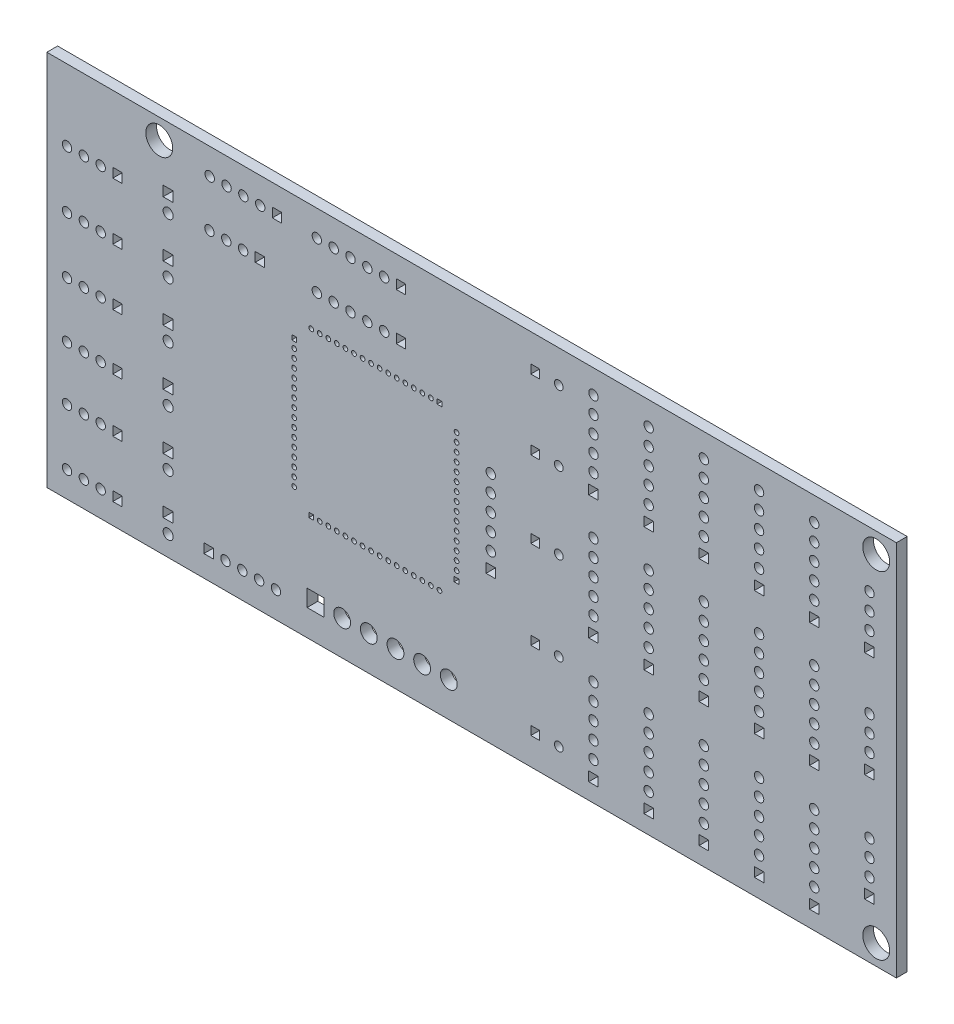
from build123d import *

# Parameters (mm, degrees)
MODEL_R             = 1.25
MODEL_R_2           = 0.35
MODEL_R_3           = 0.75
MODEL_R_4           = 0.7
MODEL_R_5           = 0.65
MODEL_R_6           = 2
MODEL_W             = 2.5
MODEL_H             = 2.5
MODEL_W_2           = 0.7
MODEL_H_2           = 0.7
MODEL_W_3           = 1.5
MODEL_H_3           = 1.5
MODEL_W_4           = 1.4
MODEL_H_4           = 1.4
MODEL_W_5           = 1.3
MODEL_H_5           = 1.3
BOSS_EXTRUDE1_DEPTH = 1.6


with BuildPart() as part:
    # Model → Boss-Extrude1 (new body)
    with BuildSketch(Plane.XY):
        Polygon((0, 0), (106, 0), (112.5, 0), (112.5, 56), (106, 56), (0, 56), (-13.7, 56), (-13.7, 0), align=None)
        with Locations((30.17, 5.14)):
            Circle(MODEL_R, mode=Mode.SUBTRACT)
        with Locations((34.13, 5.14)):
            Circle(MODEL_R, mode=Mode.SUBTRACT)
        with Locations((38.09, 5.14)):
            Circle(MODEL_R, mode=Mode.SUBTRACT)
        with Locations((42.05, 5.14)):
            Circle(MODEL_R, mode=Mode.SUBTRACT)
        with Locations((46.01, 5.14)):
            Circle(MODEL_R, mode=Mode.SUBTRACT)
        with Locations((23.035, 36.255)):
            Circle(MODEL_R_2, mode=Mode.SUBTRACT)
        with Locations((23.035, 34.985)):
            Circle(MODEL_R_2, mode=Mode.SUBTRACT)
        with Locations((23.035, 33.715)):
            Circle(MODEL_R_2, mode=Mode.SUBTRACT)
        with Locations((23.035, 32.445)):
            Circle(MODEL_R_2, mode=Mode.SUBTRACT)
        with Locations((23.035, 31.175)):
            Circle(MODEL_R_2, mode=Mode.SUBTRACT)
        with Locations((23.035, 29.905)):
            Circle(MODEL_R_2, mode=Mode.SUBTRACT)
        with Locations((23.035, 28.635)):
            Circle(MODEL_R_2, mode=Mode.SUBTRACT)
        with Locations((23.035, 27.365)):
            Circle(MODEL_R_2, mode=Mode.SUBTRACT)
        with Locations((23.035, 26.095)):
            Circle(MODEL_R_2, mode=Mode.SUBTRACT)
        with Locations((23.035, 24.825)):
            Circle(MODEL_R_2, mode=Mode.SUBTRACT)
        with Locations((23.035, 23.555)):
            Circle(MODEL_R_2, mode=Mode.SUBTRACT)
        with Locations((23.035, 22.285)):
            Circle(MODEL_R_2, mode=Mode.SUBTRACT)
        with Locations((23.035, 21.015)):
            Circle(MODEL_R_2, mode=Mode.SUBTRACT)
        with Locations((23.035, 19.745)):
            Circle(MODEL_R_2, mode=Mode.SUBTRACT)
        with Locations((23.035, 18.475)):
            Circle(MODEL_R_2, mode=Mode.SUBTRACT)
        with Locations((26.845, 15.935)):
            Circle(MODEL_R_2, mode=Mode.SUBTRACT)
        with Locations((28.115, 15.935)):
            Circle(MODEL_R_2, mode=Mode.SUBTRACT)
        with Locations((29.385, 15.935)):
            Circle(MODEL_R_2, mode=Mode.SUBTRACT)
        with Locations((30.655, 15.935)):
            Circle(MODEL_R_2, mode=Mode.SUBTRACT)
        with Locations((31.925, 15.935)):
            Circle(MODEL_R_2, mode=Mode.SUBTRACT)
        with Locations((33.195, 15.935)):
            Circle(MODEL_R_2, mode=Mode.SUBTRACT)
        with Locations((34.465, 15.935)):
            Circle(MODEL_R_2, mode=Mode.SUBTRACT)
        with Locations((35.735, 15.935)):
            Circle(MODEL_R_2, mode=Mode.SUBTRACT)
        with Locations((37.005, 15.935)):
            Circle(MODEL_R_2, mode=Mode.SUBTRACT)
        with Locations((38.275, 15.935)):
            Circle(MODEL_R_2, mode=Mode.SUBTRACT)
        with Locations((39.545, 15.935)):
            Circle(MODEL_R_2, mode=Mode.SUBTRACT)
        with Locations((40.815, 15.935)):
            Circle(MODEL_R_2, mode=Mode.SUBTRACT)
        with Locations((42.085, 15.935)):
            Circle(MODEL_R_2, mode=Mode.SUBTRACT)
        with Locations((43.355, 15.935)):
            Circle(MODEL_R_2, mode=Mode.SUBTRACT)
        with Locations((44.625, 15.935)):
            Circle(MODEL_R_2, mode=Mode.SUBTRACT)
        with Locations((47.165, 19.745)):
            Circle(MODEL_R_2, mode=Mode.SUBTRACT)
        with Locations((47.165, 21.015)):
            Circle(MODEL_R_2, mode=Mode.SUBTRACT)
        with Locations((47.165, 22.285)):
            Circle(MODEL_R_2, mode=Mode.SUBTRACT)
        with Locations((47.165, 23.555)):
            Circle(MODEL_R_2, mode=Mode.SUBTRACT)
        with Locations((47.165, 24.825)):
            Circle(MODEL_R_2, mode=Mode.SUBTRACT)
        with Locations((47.165, 26.095)):
            Circle(MODEL_R_2, mode=Mode.SUBTRACT)
        with Locations((47.165, 27.365)):
            Circle(MODEL_R_2, mode=Mode.SUBTRACT)
        with Locations((47.165, 28.635)):
            Circle(MODEL_R_2, mode=Mode.SUBTRACT)
        with Locations((47.165, 29.905)):
            Circle(MODEL_R_2, mode=Mode.SUBTRACT)
        with Locations((47.165, 31.175)):
            Circle(MODEL_R_2, mode=Mode.SUBTRACT)
        with Locations((47.165, 32.445)):
            Circle(MODEL_R_2, mode=Mode.SUBTRACT)
        with Locations((47.165, 33.715)):
            Circle(MODEL_R_2, mode=Mode.SUBTRACT)
        with Locations((47.165, 34.985)):
            Circle(MODEL_R_2, mode=Mode.SUBTRACT)
        with Locations((47.165, 36.255)):
            Circle(MODEL_R_2, mode=Mode.SUBTRACT)
        with Locations((47.165, 37.525)):
            Circle(MODEL_R_2, mode=Mode.SUBTRACT)
        with Locations((43.355, 40.065)):
            Circle(MODEL_R_2, mode=Mode.SUBTRACT)
        with Locations((42.085, 40.065)):
            Circle(MODEL_R_2, mode=Mode.SUBTRACT)
        with Locations((40.815, 40.065)):
            Circle(MODEL_R_2, mode=Mode.SUBTRACT)
        with Locations((39.545, 40.065)):
            Circle(MODEL_R_2, mode=Mode.SUBTRACT)
        with Locations((38.275, 40.065)):
            Circle(MODEL_R_2, mode=Mode.SUBTRACT)
        with Locations((37.005, 40.065)):
            Circle(MODEL_R_2, mode=Mode.SUBTRACT)
        with Locations((35.735, 40.065)):
            Circle(MODEL_R_2, mode=Mode.SUBTRACT)
        with Locations((34.465, 40.065)):
            Circle(MODEL_R_2, mode=Mode.SUBTRACT)
        with Locations((33.195, 40.065)):
            Circle(MODEL_R_2, mode=Mode.SUBTRACT)
        with Locations((31.925, 40.065)):
            Circle(MODEL_R_2, mode=Mode.SUBTRACT)
        with Locations((30.655, 40.065)):
            Circle(MODEL_R_2, mode=Mode.SUBTRACT)
        with Locations((29.385, 40.065)):
            Circle(MODEL_R_2, mode=Mode.SUBTRACT)
        with Locations((28.115, 40.065)):
            Circle(MODEL_R_2, mode=Mode.SUBTRACT)
        with Locations((26.845, 40.065)):
            Circle(MODEL_R_2, mode=Mode.SUBTRACT)
        with Locations((25.575, 40.065)):
            Circle(MODEL_R_2, mode=Mode.SUBTRACT)
        with Locations((4.32, 44.29)):
            Circle(MODEL_R_3, mode=Mode.SUBTRACT)
        with Locations((4.32, 36.035)):
            Circle(MODEL_R_3, mode=Mode.SUBTRACT)
        with Locations((4.32, 27.78)):
            Circle(MODEL_R_3, mode=Mode.SUBTRACT)
        with Locations((4.32, 19.525)):
            Circle(MODEL_R_3, mode=Mode.SUBTRACT)
        with Locations((4.32, 11.27)):
            Circle(MODEL_R_3, mode=Mode.SUBTRACT)
        with Locations((4.32, 3.015)):
            Circle(MODEL_R_3, mode=Mode.SUBTRACT)
        with Locations((92.1, 42.5)):
            Circle(MODEL_R_4, mode=Mode.SUBTRACT)
        with Locations((92.1, 45)):
            Circle(MODEL_R_4, mode=Mode.SUBTRACT)
        with Locations((92.1, 47.5)):
            Circle(MODEL_R_4, mode=Mode.SUBTRACT)
        with Locations((92.1, 50)):
            Circle(MODEL_R_4, mode=Mode.SUBTRACT)
        with Locations((92.1, 52.5)):
            Circle(MODEL_R_4, mode=Mode.SUBTRACT)
        with Locations((83.9, 42.5)):
            Circle(MODEL_R_4, mode=Mode.SUBTRACT)
        with Locations((83.9, 45)):
            Circle(MODEL_R_4, mode=Mode.SUBTRACT)
        with Locations((83.9, 47.5)):
            Circle(MODEL_R_4, mode=Mode.SUBTRACT)
        with Locations((83.9, 50)):
            Circle(MODEL_R_4, mode=Mode.SUBTRACT)
        with Locations((83.9, 52.5)):
            Circle(MODEL_R_4, mode=Mode.SUBTRACT)
        with Locations((75.7, 42.5)):
            Circle(MODEL_R_4, mode=Mode.SUBTRACT)
        with Locations((75.7, 45)):
            Circle(MODEL_R_4, mode=Mode.SUBTRACT)
        with Locations((75.7, 47.5)):
            Circle(MODEL_R_4, mode=Mode.SUBTRACT)
        with Locations((75.7, 50)):
            Circle(MODEL_R_4, mode=Mode.SUBTRACT)
        with Locations((75.7, 52.5)):
            Circle(MODEL_R_4, mode=Mode.SUBTRACT)
        with Locations((67.5, 42.5)):
            Circle(MODEL_R_4, mode=Mode.SUBTRACT)
        with Locations((67.5, 45)):
            Circle(MODEL_R_4, mode=Mode.SUBTRACT)
        with Locations((67.5, 47.5)):
            Circle(MODEL_R_4, mode=Mode.SUBTRACT)
        with Locations((67.5, 50)):
            Circle(MODEL_R_4, mode=Mode.SUBTRACT)
        with Locations((67.5, 52.5)):
            Circle(MODEL_R_4, mode=Mode.SUBTRACT)
        with Locations((92.1, 24.1)):
            Circle(MODEL_R_4, mode=Mode.SUBTRACT)
        with Locations((92.1, 26.6)):
            Circle(MODEL_R_4, mode=Mode.SUBTRACT)
        with Locations((92.1, 29.1)):
            Circle(MODEL_R_4, mode=Mode.SUBTRACT)
        with Locations((92.1, 31.6)):
            Circle(MODEL_R_4, mode=Mode.SUBTRACT)
        with Locations((92.1, 34.1)):
            Circle(MODEL_R_4, mode=Mode.SUBTRACT)
        with Locations((83.9, 24.1)):
            Circle(MODEL_R_4, mode=Mode.SUBTRACT)
        with Locations((83.9, 26.6)):
            Circle(MODEL_R_4, mode=Mode.SUBTRACT)
        with Locations((83.9, 29.1)):
            Circle(MODEL_R_4, mode=Mode.SUBTRACT)
        with Locations((83.9, 31.6)):
            Circle(MODEL_R_4, mode=Mode.SUBTRACT)
        with Locations((83.9, 34.1)):
            Circle(MODEL_R_4, mode=Mode.SUBTRACT)
        with Locations((75.7, 24.1)):
            Circle(MODEL_R_4, mode=Mode.SUBTRACT)
        with Locations((75.7, 26.6)):
            Circle(MODEL_R_4, mode=Mode.SUBTRACT)
        with Locations((75.7, 29.1)):
            Circle(MODEL_R_4, mode=Mode.SUBTRACT)
        with Locations((75.7, 31.6)):
            Circle(MODEL_R_4, mode=Mode.SUBTRACT)
        with Locations((75.7, 34.1)):
            Circle(MODEL_R_4, mode=Mode.SUBTRACT)
        with Locations((67.5, 24.1)):
            Circle(MODEL_R_4, mode=Mode.SUBTRACT)
        with Locations((67.5, 26.6)):
            Circle(MODEL_R_4, mode=Mode.SUBTRACT)
        with Locations((67.5, 29.1)):
            Circle(MODEL_R_4, mode=Mode.SUBTRACT)
        with Locations((67.5, 31.6)):
            Circle(MODEL_R_4, mode=Mode.SUBTRACT)
        with Locations((67.5, 34.1)):
            Circle(MODEL_R_4, mode=Mode.SUBTRACT)
        with Locations((100.3, 5.6)):
            Circle(MODEL_R_4, mode=Mode.SUBTRACT)
        with Locations((100.3, 8.1)):
            Circle(MODEL_R_4, mode=Mode.SUBTRACT)
        with Locations((100.3, 10.6)):
            Circle(MODEL_R_4, mode=Mode.SUBTRACT)
        with Locations((100.3, 13.1)):
            Circle(MODEL_R_4, mode=Mode.SUBTRACT)
        with Locations((100.3, 15.6)):
            Circle(MODEL_R_4, mode=Mode.SUBTRACT)
        with Locations((92.1, 5.6)):
            Circle(MODEL_R_4, mode=Mode.SUBTRACT)
        with Locations((92.1, 8.1)):
            Circle(MODEL_R_4, mode=Mode.SUBTRACT)
        with Locations((92.1, 10.6)):
            Circle(MODEL_R_4, mode=Mode.SUBTRACT)
        with Locations((92.1, 13.1)):
            Circle(MODEL_R_4, mode=Mode.SUBTRACT)
        with Locations((92.1, 15.6)):
            Circle(MODEL_R_4, mode=Mode.SUBTRACT)
        with Locations((83.9, 5.6)):
            Circle(MODEL_R_4, mode=Mode.SUBTRACT)
        with Locations((83.9, 8.1)):
            Circle(MODEL_R_4, mode=Mode.SUBTRACT)
        with Locations((83.9, 10.6)):
            Circle(MODEL_R_4, mode=Mode.SUBTRACT)
        with Locations((83.9, 13.1)):
            Circle(MODEL_R_4, mode=Mode.SUBTRACT)
        with Locations((83.9, 15.6)):
            Circle(MODEL_R_4, mode=Mode.SUBTRACT)
        with Locations((75.7, 5.6)):
            Circle(MODEL_R_4, mode=Mode.SUBTRACT)
        with Locations((75.7, 8.1)):
            Circle(MODEL_R_4, mode=Mode.SUBTRACT)
        with Locations((75.7, 10.6)):
            Circle(MODEL_R_4, mode=Mode.SUBTRACT)
        with Locations((75.7, 13.1)):
            Circle(MODEL_R_4, mode=Mode.SUBTRACT)
        with Locations((75.7, 15.6)):
            Circle(MODEL_R_4, mode=Mode.SUBTRACT)
        with Locations((67.5, 5.6)):
            Circle(MODEL_R_4, mode=Mode.SUBTRACT)
        with Locations((67.5, 8.1)):
            Circle(MODEL_R_4, mode=Mode.SUBTRACT)
        with Locations((67.5, 10.6)):
            Circle(MODEL_R_4, mode=Mode.SUBTRACT)
        with Locations((67.5, 13.1)):
            Circle(MODEL_R_4, mode=Mode.SUBTRACT)
        with Locations((67.5, 15.6)):
            Circle(MODEL_R_4, mode=Mode.SUBTRACT)
        with Locations((100.3, 24.1)):
            Circle(MODEL_R_4, mode=Mode.SUBTRACT)
        with Locations((100.3, 26.6)):
            Circle(MODEL_R_4, mode=Mode.SUBTRACT)
        with Locations((100.3, 29.1)):
            Circle(MODEL_R_4, mode=Mode.SUBTRACT)
        with Locations((100.3, 31.6)):
            Circle(MODEL_R_4, mode=Mode.SUBTRACT)
        with Locations((100.3, 34.1)):
            Circle(MODEL_R_4, mode=Mode.SUBTRACT)
        with Locations((100.3, 42.5)):
            Circle(MODEL_R_4, mode=Mode.SUBTRACT)
        with Locations((100.3, 45)):
            Circle(MODEL_R_4, mode=Mode.SUBTRACT)
        with Locations((100.3, 47.5)):
            Circle(MODEL_R_4, mode=Mode.SUBTRACT)
        with Locations((100.3, 50)):
            Circle(MODEL_R_4, mode=Mode.SUBTRACT)
        with Locations((100.3, 52.5)):
            Circle(MODEL_R_4, mode=Mode.SUBTRACT)
        with Locations((36.41, 52.13)):
            Circle(MODEL_R_4, mode=Mode.SUBTRACT)
        with Locations((33.91, 52.13)):
            Circle(MODEL_R_4, mode=Mode.SUBTRACT)
        with Locations((31.41, 52.13)):
            Circle(MODEL_R_4, mode=Mode.SUBTRACT)
        with Locations((28.91, 52.13)):
            Circle(MODEL_R_4, mode=Mode.SUBTRACT)
        with Locations((26.41, 52.13)):
            Circle(MODEL_R_4, mode=Mode.SUBTRACT)
        with Locations((36.41, 45.145)):
            Circle(MODEL_R_4, mode=Mode.SUBTRACT)
        with Locations((33.91, 45.145)):
            Circle(MODEL_R_4, mode=Mode.SUBTRACT)
        with Locations((31.41, 45.145)):
            Circle(MODEL_R_4, mode=Mode.SUBTRACT)
        with Locations((28.91, 45.145)):
            Circle(MODEL_R_4, mode=Mode.SUBTRACT)
        with Locations((26.41, 45.145)):
            Circle(MODEL_R_4, mode=Mode.SUBTRACT)
        with Locations((52.245, 24.785)):
            Circle(MODEL_R_4, mode=Mode.SUBTRACT)
        with Locations((52.245, 27.285)):
            Circle(MODEL_R_4, mode=Mode.SUBTRACT)
        with Locations((52.245, 29.785)):
            Circle(MODEL_R_4, mode=Mode.SUBTRACT)
        with Locations((52.245, 32.285)):
            Circle(MODEL_R_4, mode=Mode.SUBTRACT)
        with Locations((52.245, 34.785)):
            Circle(MODEL_R_4, mode=Mode.SUBTRACT)
        with Locations((17.995, 52.13)):
            Circle(MODEL_R_4, mode=Mode.SUBTRACT)
        with Locations((15.495, 52.13)):
            Circle(MODEL_R_4, mode=Mode.SUBTRACT)
        with Locations((12.995, 52.13)):
            Circle(MODEL_R_4, mode=Mode.SUBTRACT)
        with Locations((10.495, 52.13)):
            Circle(MODEL_R_4, mode=Mode.SUBTRACT)
        with Locations((12.835, 3.87)):
            Circle(MODEL_R_4, mode=Mode.SUBTRACT)
        with Locations((15.335, 3.87)):
            Circle(MODEL_R_4, mode=Mode.SUBTRACT)
        with Locations((17.835, 3.87)):
            Circle(MODEL_R_4, mode=Mode.SUBTRACT)
        with Locations((20.335, 3.87)):
            Circle(MODEL_R_4, mode=Mode.SUBTRACT)
        with Locations((-5.7, 3.8)):
            Circle(MODEL_R_4, mode=Mode.SUBTRACT)
        with Locations((-8.2, 3.8)):
            Circle(MODEL_R_4, mode=Mode.SUBTRACT)
        with Locations((-10.7, 3.8)):
            Circle(MODEL_R_4, mode=Mode.SUBTRACT)
        with Locations((-5.7, 12.2)):
            Circle(MODEL_R_4, mode=Mode.SUBTRACT)
        with Locations((-8.2, 12.2)):
            Circle(MODEL_R_4, mode=Mode.SUBTRACT)
        with Locations((-10.7, 12.2)):
            Circle(MODEL_R_4, mode=Mode.SUBTRACT)
        with Locations((-5.7, 20.2)):
            Circle(MODEL_R_4, mode=Mode.SUBTRACT)
        with Locations((-8.2, 20.2)):
            Circle(MODEL_R_4, mode=Mode.SUBTRACT)
        with Locations((-10.7, 20.2)):
            Circle(MODEL_R_4, mode=Mode.SUBTRACT)
        with Locations((-5.7, 28.5)):
            Circle(MODEL_R_4, mode=Mode.SUBTRACT)
        with Locations((-8.2, 28.5)):
            Circle(MODEL_R_4, mode=Mode.SUBTRACT)
        with Locations((-10.7, 28.5)):
            Circle(MODEL_R_4, mode=Mode.SUBTRACT)
        with Locations((-5.7, 36.9)):
            Circle(MODEL_R_4, mode=Mode.SUBTRACT)
        with Locations((-8.2, 36.9)):
            Circle(MODEL_R_4, mode=Mode.SUBTRACT)
        with Locations((-10.7, 36.9)):
            Circle(MODEL_R_4, mode=Mode.SUBTRACT)
        with Locations((-5.7, 45.4)):
            Circle(MODEL_R_4, mode=Mode.SUBTRACT)
        with Locations((-8.2, 45.4)):
            Circle(MODEL_R_4, mode=Mode.SUBTRACT)
        with Locations((-10.7, 45.4)):
            Circle(MODEL_R_4, mode=Mode.SUBTRACT)
        with Locations((15.455, 45.145)):
            Circle(MODEL_R_4, mode=Mode.SUBTRACT)
        with Locations((12.955, 45.145)):
            Circle(MODEL_R_4, mode=Mode.SUBTRACT)
        with Locations((10.455, 45.145)):
            Circle(MODEL_R_4, mode=Mode.SUBTRACT)
        with Locations((108.5, 42.7)):
            Circle(MODEL_R_4, mode=Mode.SUBTRACT)
        with Locations((108.5, 45.2)):
            Circle(MODEL_R_4, mode=Mode.SUBTRACT)
        with Locations((108.5, 47.7)):
            Circle(MODEL_R_4, mode=Mode.SUBTRACT)
        with Locations((108.5, 27)):
            Circle(MODEL_R_4, mode=Mode.SUBTRACT)
        with Locations((108.5, 29.5)):
            Circle(MODEL_R_4, mode=Mode.SUBTRACT)
        with Locations((108.5, 32)):
            Circle(MODEL_R_4, mode=Mode.SUBTRACT)
        with Locations((108.5, 11)):
            Circle(MODEL_R_4, mode=Mode.SUBTRACT)
        with Locations((108.5, 13.5)):
            Circle(MODEL_R_4, mode=Mode.SUBTRACT)
        with Locations((108.5, 16)):
            Circle(MODEL_R_4, mode=Mode.SUBTRACT)
        with Locations((62.35, 4.7)):
            Circle(MODEL_R_5, mode=Mode.SUBTRACT)
        with Locations((62.35, 16.3)):
            Circle(MODEL_R_5, mode=Mode.SUBTRACT)
        with Locations((62.35, 29.4)):
            Circle(MODEL_R_5, mode=Mode.SUBTRACT)
        with Locations((62.35, 51.2)):
            Circle(MODEL_R_5, mode=Mode.SUBTRACT)
        with Locations((62.35, 40.8)):
            Circle(MODEL_R_5, mode=Mode.SUBTRACT)
        with Locations((3, 53)):
            Circle(MODEL_R_6, mode=Mode.SUBTRACT)
        with Locations((109.5, 3)):
            Circle(MODEL_R_6, mode=Mode.SUBTRACT)
        with Locations((109.5, 53)):
            Circle(MODEL_R_6, mode=Mode.SUBTRACT)
        with Locations((26.21, 5.14)):
            Rectangle(MODEL_W, MODEL_H, mode=Mode.SUBTRACT)
        with Locations((23.035, 37.525)):
            Rectangle(MODEL_W_2, MODEL_H_2, mode=Mode.SUBTRACT)
        with Locations((25.575, 15.935)):
            Rectangle(MODEL_W_2, MODEL_H_2, mode=Mode.SUBTRACT)
        with Locations((47.165, 18.475)):
            Rectangle(MODEL_W_2, MODEL_H_2, mode=Mode.SUBTRACT)
        with Locations((44.625, 40.065)):
            Rectangle(MODEL_W_2, MODEL_H_2, mode=Mode.SUBTRACT)
        with Locations((4.32, 46.79)):
            Rectangle(MODEL_W_3, MODEL_H_3, mode=Mode.SUBTRACT)
        with Locations((4.32, 38.535)):
            Rectangle(MODEL_W_3, MODEL_H_3, mode=Mode.SUBTRACT)
        with Locations((4.32, 30.28)):
            Rectangle(MODEL_W_3, MODEL_H_3, mode=Mode.SUBTRACT)
        with Locations((4.32, 22.025)):
            Rectangle(MODEL_W_3, MODEL_H_3, mode=Mode.SUBTRACT)
        with Locations((4.32, 13.77)):
            Rectangle(MODEL_W_3, MODEL_H_3, mode=Mode.SUBTRACT)
        with Locations((4.32, 5.515)):
            Rectangle(MODEL_W_3, MODEL_H_3, mode=Mode.SUBTRACT)
        with Locations((92.1, 40)):
            Rectangle(MODEL_W_4, MODEL_H_4, mode=Mode.SUBTRACT)
        with Locations((83.9, 40)):
            Rectangle(MODEL_W_4, MODEL_H_4, mode=Mode.SUBTRACT)
        with Locations((75.7, 40)):
            Rectangle(MODEL_W_4, MODEL_H_4, mode=Mode.SUBTRACT)
        with Locations((67.5, 40)):
            Rectangle(MODEL_W_4, MODEL_H_4, mode=Mode.SUBTRACT)
        with Locations((92.1, 21.6)):
            Rectangle(MODEL_W_4, MODEL_H_4, mode=Mode.SUBTRACT)
        with Locations((83.9, 21.6)):
            Rectangle(MODEL_W_4, MODEL_H_4, mode=Mode.SUBTRACT)
        with Locations((75.7, 21.6)):
            Rectangle(MODEL_W_4, MODEL_H_4, mode=Mode.SUBTRACT)
        with Locations((67.5, 21.6)):
            Rectangle(MODEL_W_4, MODEL_H_4, mode=Mode.SUBTRACT)
        with Locations((100.3, 3.1)):
            Rectangle(MODEL_W_4, MODEL_H_4, mode=Mode.SUBTRACT)
        with Locations((92.1, 3.1)):
            Rectangle(MODEL_W_4, MODEL_H_4, mode=Mode.SUBTRACT)
        with Locations((83.9, 3.1)):
            Rectangle(MODEL_W_4, MODEL_H_4, mode=Mode.SUBTRACT)
        with Locations((75.7, 3.1)):
            Rectangle(MODEL_W_4, MODEL_H_4, mode=Mode.SUBTRACT)
        with Locations((67.5, 3.1)):
            Rectangle(MODEL_W_4, MODEL_H_4, mode=Mode.SUBTRACT)
        with Locations((100.3, 21.6)):
            Rectangle(MODEL_W_4, MODEL_H_4, mode=Mode.SUBTRACT)
        with Locations((100.3, 40)):
            Rectangle(MODEL_W_4, MODEL_H_4, mode=Mode.SUBTRACT)
        with Locations((38.91, 52.13)):
            Rectangle(MODEL_W_4, MODEL_H_4, mode=Mode.SUBTRACT)
        with Locations((38.91, 45.145)):
            Rectangle(MODEL_W_4, MODEL_H_4, mode=Mode.SUBTRACT)
        with Locations((52.245, 22.285)):
            Rectangle(MODEL_W_4, MODEL_H_4, mode=Mode.SUBTRACT)
        with Locations((20.495, 52.13)):
            Rectangle(MODEL_W_4, MODEL_H_4, mode=Mode.SUBTRACT)
        with Locations((10.335, 3.87)):
            Rectangle(MODEL_W_4, MODEL_H_4, mode=Mode.SUBTRACT)
        with Locations((-3.2, 3.8)):
            Rectangle(MODEL_W_4, MODEL_H_4, mode=Mode.SUBTRACT)
        with Locations((-3.2, 12.2)):
            Rectangle(MODEL_W_4, MODEL_H_4, mode=Mode.SUBTRACT)
        with Locations((-3.2, 20.2)):
            Rectangle(MODEL_W_4, MODEL_H_4, mode=Mode.SUBTRACT)
        with Locations((-3.2, 28.5)):
            Rectangle(MODEL_W_4, MODEL_H_4, mode=Mode.SUBTRACT)
        with Locations((-3.2, 36.9)):
            Rectangle(MODEL_W_4, MODEL_H_4, mode=Mode.SUBTRACT)
        with Locations((-3.2, 45.4)):
            Rectangle(MODEL_W_4, MODEL_H_4, mode=Mode.SUBTRACT)
        with Locations((17.955, 45.145)):
            Rectangle(MODEL_W_4, MODEL_H_4, mode=Mode.SUBTRACT)
        with Locations((108.5, 40.2)):
            Rectangle(MODEL_W_4, MODEL_H_4, mode=Mode.SUBTRACT)
        with Locations((108.5, 24.5)):
            Rectangle(MODEL_W_4, MODEL_H_4, mode=Mode.SUBTRACT)
        with Locations((108.5, 8.5)):
            Rectangle(MODEL_W_4, MODEL_H_4, mode=Mode.SUBTRACT)
        with Locations((58.85, 4.7)):
            Rectangle(MODEL_W_5, MODEL_H_5, mode=Mode.SUBTRACT)
        with Locations((58.85, 16.3)):
            Rectangle(MODEL_W_5, MODEL_H_5, mode=Mode.SUBTRACT)
        with Locations((58.85, 29.4)):
            Rectangle(MODEL_W_5, MODEL_H_5, mode=Mode.SUBTRACT)
        with Locations((58.85, 51.2)):
            Rectangle(MODEL_W_5, MODEL_H_5, mode=Mode.SUBTRACT)
        with Locations((58.85, 40.8)):
            Rectangle(MODEL_W_5, MODEL_H_5, mode=Mode.SUBTRACT)
    extrude(amount=BOSS_EXTRUDE1_DEPTH)


solid = part.part
